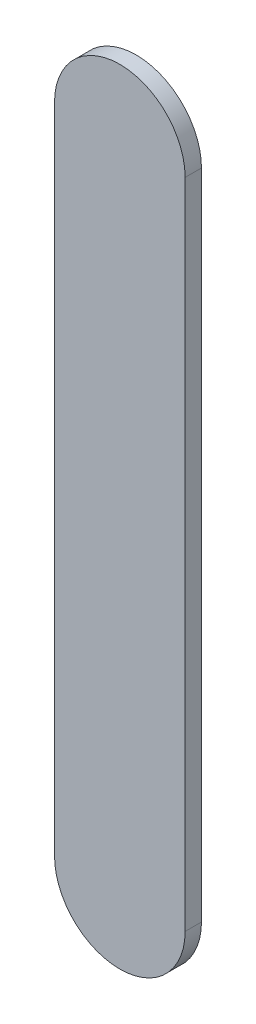
from build123d import *

# Parameters (mm, degrees)
BOSS_EXTRUDE1_DEPTH = 1


with BuildPart() as part:
    # Sketch1 → Boss-Extrude1 (new body)
    with BuildSketch(Plane.XY):
        with BuildLine():
            Line((0, 0), (0, 40))
            ThreePointArc((0, 40), (4, 44), (8, 40))
            Line((8, 40), (8, 0))
            ThreePointArc((8, 0), (4, -4), (0, 0))
        make_face()
    extrude(amount=BOSS_EXTRUDE1_DEPTH)


solid = part.part
